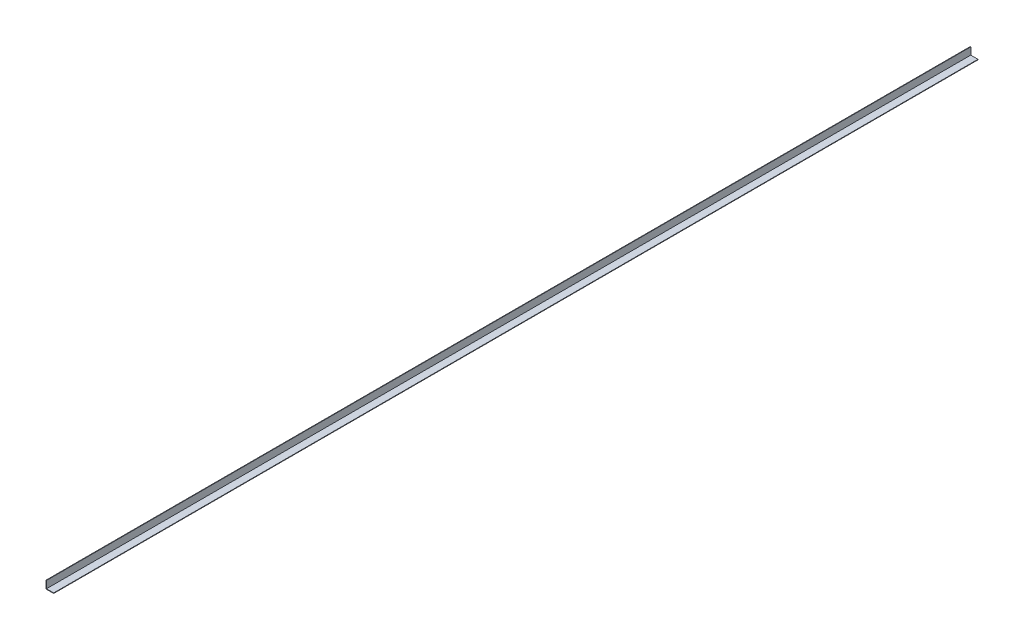
from build123d import *

# Parameters (mm, degrees)
SALIENTE_EXTRUIR1_DEPTH = 6100


with BuildPart() as part:
    # Croquis1 → Saliente-Extruir1 (new body)
    with BuildSketch(Plane.XY):
        Polygon((0, 50.8), (0, 0), (50.8, 0), (50.8, 3.18), (3.18, 3.18), (3.18, 50.8), align=None)
    extrude(amount=-SALIENTE_EXTRUIR1_DEPTH)


solid = part.part
